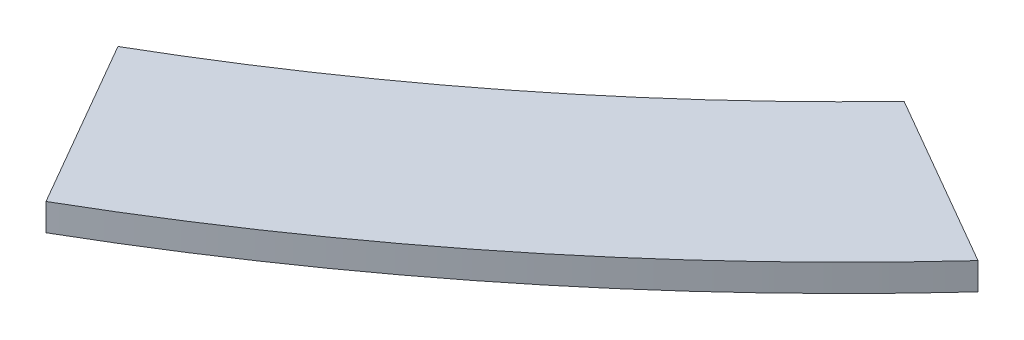
from build123d import *

# Parameters (mm, degrees)
BOSS_EXTRUDE1_DEPTH = 0.762


with BuildPart() as part:
    # Sketch1 → Boss-Extrude1 (new body)
    with BuildSketch(Plane(origin=(0, 0, 0), x_dir=(1, 0, 0), z_dir=(0, 1, 0))):
        with BuildLine():
            ThreePointArc((40.32786287, -38.681234163), (34.47763478, -43.975755821), (27.94, -48.393499563))
            Line((27.94, -48.393499563), (29.845, -51.693056352))
            ThreePointArc((29.845, -51.693056352), (37.194959, -46.68437774), (43.719059778, -40.639142611))
            Line((43.719059778, -40.639142611), (40.32786287, -38.681234163))
        make_face()
        with BuildLine():
            ThreePointArc((43.719059778, -40.639142611), (37.194959, -46.68437774), (29.845, -51.693056352))
            Line((29.845, -51.693056352), (30.70225, -53.177856907))
            ThreePointArc((30.70225, -53.177856907), (38.416686562, -47.902722406), (45.241244894, -41.517976597))
            Line((45.241244894, -41.517976597), (43.719059778, -40.639142611))
        make_face()
    extrude(amount=BOSS_EXTRUDE1_DEPTH)


solid = part.part
